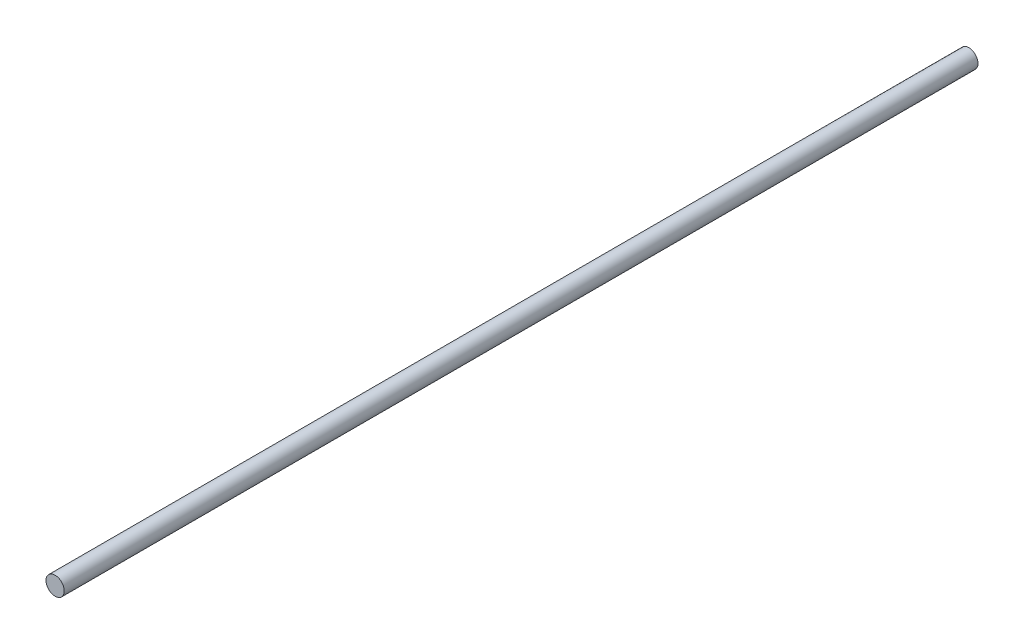
from build123d import *

# Parameters (mm, degrees)
SKETCH_1_R      = 1
EXTRUDE_1_DEPTH = 100


with BuildPart() as part:
    # ｽｹｯﾁ1 → ﾎﾞｽ - 押し出し1 (new body)
    with BuildSketch(Plane.XY):
        Circle(SKETCH_1_R)
    extrude(amount=EXTRUDE_1_DEPTH)


solid = part.part
